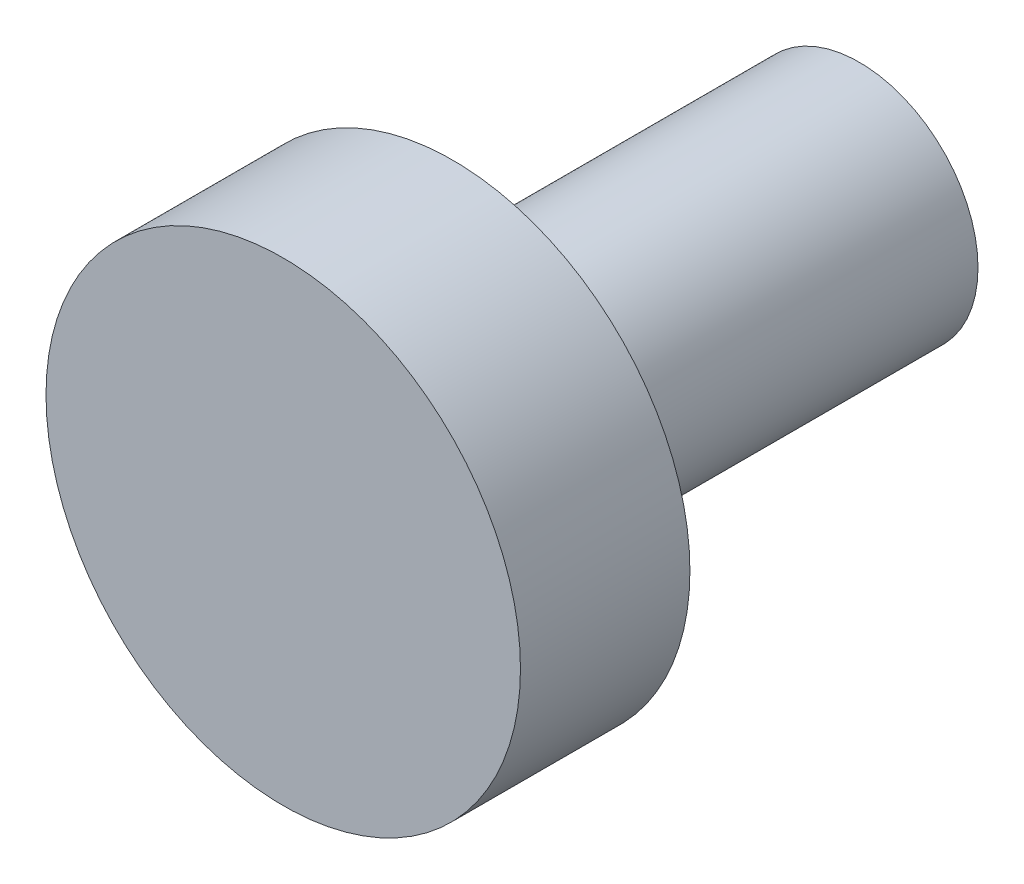
from build123d import *

# Parameters (mm, degrees)
SKETCH1_R           = 1.75
BOSS_EXTRUDE1_DEPTH = 6
SKETCH2_R           = 3.5
BOSS_EXTRUDE2_DEPTH = 2.5


with BuildPart() as part:
    # Sketch1 → Boss-Extrude1 (new body)
    with BuildSketch(Plane.XY):
        Circle(SKETCH1_R)
    extrude(amount=BOSS_EXTRUDE1_DEPTH)

    # Sketch2 → Boss-Extrude2 (add)
    with BuildSketch(Plane.XY.offset(6)):
        Circle(SKETCH2_R)
    extrude(amount=BOSS_EXTRUDE2_DEPTH)


solid = part.part
